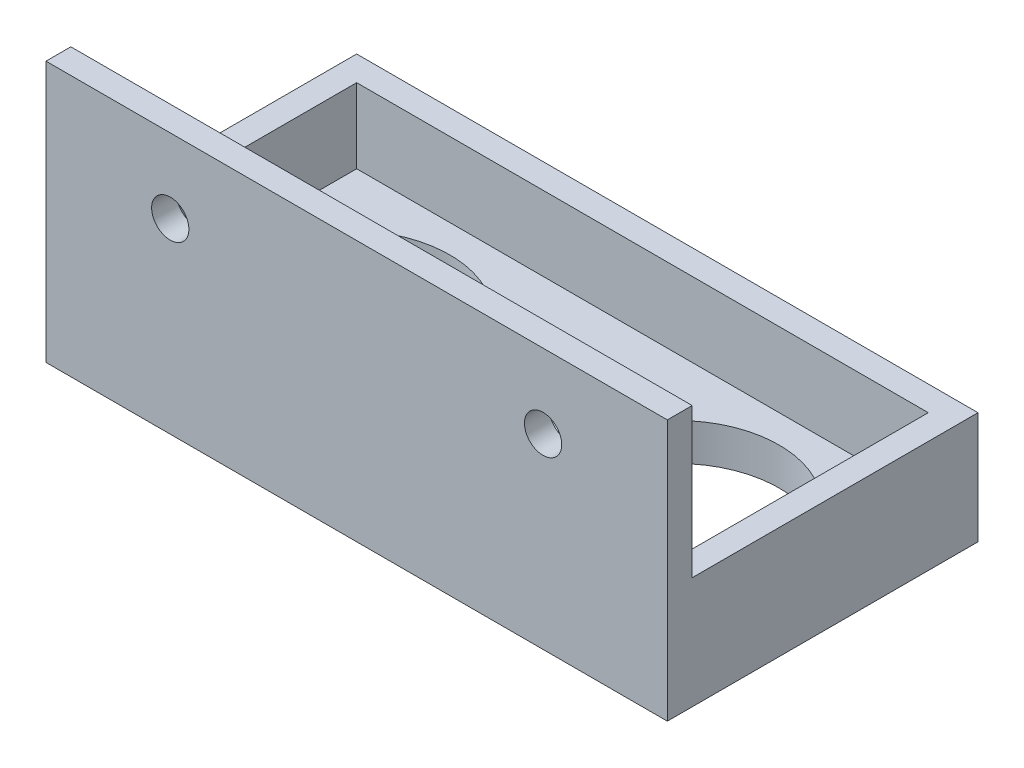
from build123d import *

# Parameters (mm, degrees)
SKETCH1_W           = 50
SKETCH1_H           = 25
BOSS_EXTRUDE2_DEPTH = 3
SKETCH3_R           = 8.25
CUT_EXTRUDE2_DEPTH  = 29.111385594
SKETCH6_W           = 50
SKETCH6_H           = 25
SKETCH6_W_2         = 46
SKETCH6_H_2         = 21
BOSS_EXTRUDE3_DEPTH = 6
SKETCH7_W           = 50
SKETCH7_H           = 2
BOSS_EXTRUDE4_DEPTH = 12
SKETCH9_R           = 1.5
CUT_EXTRUDE3_DEPTH  = 40.937451095


with BuildPart() as part:
    # Sketch1 → Boss-Extrude2 (new body)
    with BuildSketch(Plane(origin=(0, 0, 0), x_dir=(1, 0, 0), z_dir=(0, 1, 0))):
        Rectangle(SKETCH1_W, SKETCH1_H)
    extrude(amount=BOSS_EXTRUDE2_DEPTH)

    # Sketch3 → Cut-Extrude2 (cut, through all)
    with BuildSketch(Plane(origin=(0, 3, 0), x_dir=(1, 0, 0), z_dir=(0, 1, 0))):
        with Locations(Location((13.25, 0, 0), (0, 0, 270))):
            Circle(SKETCH3_R)
        with Locations(Location((-13.25, 0, 0), (0, 0, 270))):
            Circle(SKETCH3_R)
    extrude(amount=-CUT_EXTRUDE2_DEPTH, mode=Mode.SUBTRACT)

    # Sketch6 → Boss-Extrude3 (add)
    with BuildSketch(Plane(origin=(0, 3, 0), x_dir=(1, 0, 0), z_dir=(0, 1, 0))):
        Rectangle(SKETCH6_W, SKETCH6_H)
        Rectangle(SKETCH6_W_2, SKETCH6_H_2, mode=Mode.SUBTRACT)
    extrude(amount=BOSS_EXTRUDE3_DEPTH)

    # Sketch7 → Boss-Extrude4 (add)
    with BuildSketch(Plane(origin=(0, 9, 0), x_dir=(1, 0, 0), z_dir=(0, 1, 0))):
        with Locations((0, -11.5)):
            Rectangle(SKETCH7_W, SKETCH7_H)
    extrude(amount=BOSS_EXTRUDE4_DEPTH)

    # Sketch9 → Cut-Extrude3 (cut, through all)
    with BuildSketch(Plane(origin=(0, 0, 10.5), x_dir=(-1, 0, 0), z_dir=(0, 0, -1))):
        with Locations((-15, 15.02673795)):
            Circle(SKETCH9_R)
        with Locations((15, 15.02673795)):
            Circle(SKETCH9_R)
    extrude(amount=-CUT_EXTRUDE3_DEPTH, mode=Mode.SUBTRACT)


solid = part.part
